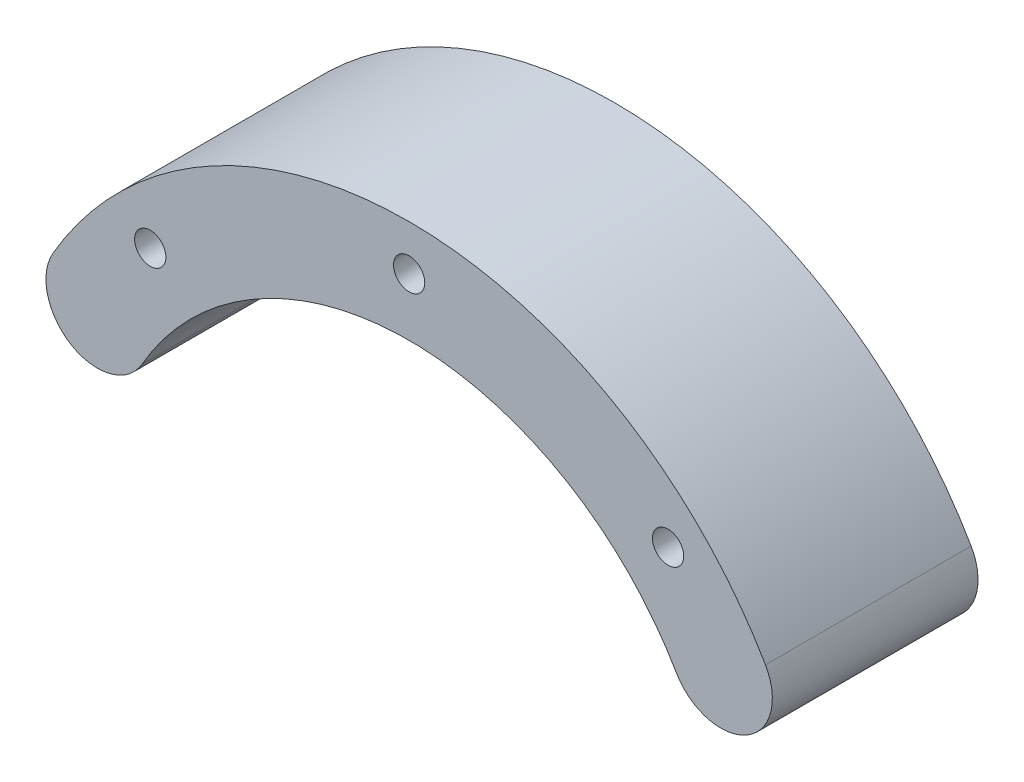
from build123d import *

# Parameters (mm, degrees)
SKETCH_2_R      = 1.9
EXTRUDE_1_DEPTH = 25


with BuildPart() as part:
    # 草图2 → 凸台-拉伸1 (new body)
    with BuildSketch(Plane.XY):
        with BuildLine():
            ThreePointArc((48.648502372, 20.987730677), (16.17254973, 39.737730677), (-16.303402912, 20.987730677))
            ThreePointArc((-16.303402912, 20.987730677), (-24.841061686, 18.700071903), (-27.128720459, 27.237730677))
            ThreePointArc((-27.128720459, 27.237730677), (16.17254973, 52.237730677), (59.473819919, 27.237730677))
            ThreePointArc((59.473819919, 27.237730677), (57.186161145, 18.700071903), (48.648502372, 20.987730677))
        make_face()
        with Locations((-15.293702033, 33.70398244)):
            Circle(SKETCH_2_R, mode=Mode.SUBTRACT)
        with Locations((16.17254973, 46.737730677)):
            Circle(SKETCH_2_R, mode=Mode.SUBTRACT)
        with Locations((47.638801493, 33.70398244)):
            Circle(SKETCH_2_R, mode=Mode.SUBTRACT)
    extrude(amount=EXTRUDE_1_DEPTH)


solid = part.part
